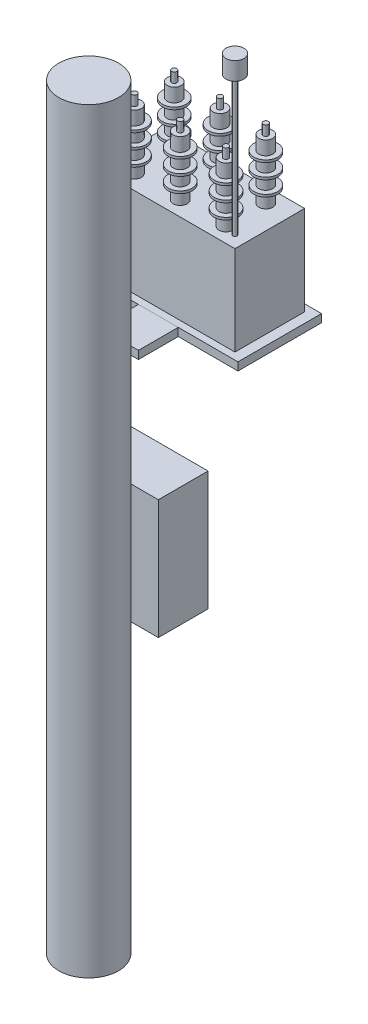
from build123d import *

# Parameters (mm, degrees)
SKETCH1_W               = 700
SKETCH1_H               = 350
TANK_DEPTH              = 450
FRAME_START             = -40
SKETCH2_W               = 800
SKETCH2_H               = 420
FRAME_DEPTH             = 40
SKETCH3_W               = 200
SKETCH3_H               = 200
FRAME_ARM_DEPTH         = 40
CONTROL_START           = -1200
SKETCH4_W               = 400
SKETCH4_H               = 250
CONTROL_CABINET_DEPTH   = 600
POLE_START              = -2600
SKETCH5_R               = 150
POLE_DEPTH              = 3800
BUSHING_START           = 450
SKETCH6_R               = 35
BUSHING_SOURCE_A_DEPTH  = 300
SHED_START              = 519
SKETCH7_R               = 60
SHED_SOURCE_A_1_DEPTH   = 12
SHED_START_2            = 594
SKETCH8_R               = 60
SHED_SOURCE_A_2_DEPTH   = 12
SHED_START_3            = 669
SKETCH9_R               = 60
SHED_SOURCE_A_3_DEPTH   = 12
TERMINAL_START          = 750
SKETCH10_R              = 13
TERMINAL_SOURCE_A_DEPTH = 50
SKETCH11_R              = 35
BUSHING_SOURCE_B_DEPTH  = 300
SKETCH12_R              = 60
SHED_SOURCE_B_1_DEPTH   = 12
SKETCH13_R              = 60
SHED_SOURCE_B_2_DEPTH   = 12
SKETCH14_R              = 60
SHED_SOURCE_B_3_DEPTH   = 12
SKETCH15_R              = 13
TERMINAL_SOURCE_B_DEPTH = 50
SKETCH16_R              = 35
BUSHING_SOURCE_C_DEPTH  = 300
SKETCH17_R              = 60
SHED_SOURCE_C_1_DEPTH   = 12
SKETCH18_R              = 60
SHED_SOURCE_C_2_DEPTH   = 12
SKETCH19_R              = 60
SHED_SOURCE_C_3_DEPTH   = 12
SKETCH20_R              = 13
TERMINAL_SOURCE_C_DEPTH = 50
SKETCH21_R              = 35
BUSHING_LOAD_A_DEPTH    = 300
SKETCH22_R              = 60
SHED_LOAD_A_1_DEPTH     = 12
SKETCH23_R              = 60
SHED_LOAD_A_2_DEPTH     = 12
SKETCH24_R              = 60
SHED_LOAD_A_3_DEPTH     = 12
SKETCH25_R              = 13
TERMINAL_LOAD_A_DEPTH   = 50
SKETCH26_R              = 35
BUSHING_LOAD_B_DEPTH    = 300
SKETCH27_R              = 60
SHED_LOAD_B_1_DEPTH     = 12
SKETCH28_R              = 60
SHED_LOAD_B_2_DEPTH     = 12
SKETCH29_R              = 60
SHED_LOAD_B_3_DEPTH     = 12
SKETCH30_R              = 13
TERMINAL_LOAD_B_DEPTH   = 50
SKETCH31_R              = 35
BUSHING_LOAD_C_DEPTH    = 300
SKETCH32_R              = 60
SHED_LOAD_C_1_DEPTH     = 12
SKETCH33_R              = 60
SHED_LOAD_C_2_DEPTH     = 12
SKETCH34_R              = 60
SHED_LOAD_C_3_DEPTH     = 12
SKETCH35_R              = 13
TERMINAL_LOAD_C_DEPTH   = 50
ANTENNA_START           = 450
SKETCH36_R              = 10
ANTENNA_MAST_DEPTH      = 700
ANTENNA_START_2         = 1150
SKETCH37_R              = 45
ANTENNA_RADOME_DEPTH    = 90


with BuildPart() as part:
    # Sketch1 → Tank (new body)
    with BuildSketch(Plane(origin=(0, 0, 0), x_dir=(1, 0, 0), z_dir=(0, 1, 0))):
        Rectangle(SKETCH1_W, SKETCH1_H)
    extrude(amount=TANK_DEPTH)


with BuildPart() as body_2:
    # Sketch2 → Frame (new body)
    with BuildSketch(Plane(origin=(0, 0, 0), x_dir=(1, 0, 0), z_dir=(0, 1, 0)).offset(FRAME_START)):
        Rectangle(SKETCH2_W, SKETCH2_H)
    extrude(amount=FRAME_DEPTH)


with BuildPart() as body_3:
    # Sketch3 → Frame arm (new body)
    with BuildSketch(Plane(origin=(0, 0, 0), x_dir=(1, 0, 0), z_dir=(0, 1, 0)).offset(FRAME_START)):
        with Locations((0, -310)):
            Rectangle(SKETCH3_W, SKETCH3_H)
    extrude(amount=FRAME_ARM_DEPTH)


with BuildPart() as body_4:
    # Sketch4 → Control cabinet (new body)
    with BuildSketch(Plane(origin=(0, 0, 0), x_dir=(1, 0, 0), z_dir=(0, 1, 0)).offset(CONTROL_START)):
        with Locations((0, -285)):
            Rectangle(SKETCH4_W, SKETCH4_H)
    extrude(amount=CONTROL_CABINET_DEPTH)


with BuildPart() as body_5:
    # Sketch5 → Pole (new body)
    with BuildSketch(Plane(origin=(0, 0, 0), x_dir=(1, 0, 0), z_dir=(0, 1, 0)).offset(POLE_START)):
        with Locations(Location((0, -560, 0), (0, 0, 90))):
            Circle(SKETCH5_R)
    extrude(amount=POLE_DEPTH)


with BuildPart() as body_6:
    # Sketch6 → Bushing Source A (new body)
    with BuildSketch(Plane(origin=(0, 0, 0), x_dir=(1, 0, 0), z_dir=(0, 1, 0)).offset(BUSHING_START)):
        with Locations(Location((-230, 100, 0), (0, 0, 270))):
            Circle(SKETCH6_R)
    extrude(amount=BUSHING_SOURCE_A_DEPTH)


with BuildPart() as body_7:
    # Sketch7 → Shed Source A 1 (new body)
    with BuildSketch(Plane(origin=(0, 0, 0), x_dir=(1, 0, 0), z_dir=(0, 1, 0)).offset(SHED_START)):
        with Locations(Location((-230, 100, 0), (0, 0, 270))):
            Circle(SKETCH7_R)
    extrude(amount=SHED_SOURCE_A_1_DEPTH)


with BuildPart() as body_8:
    # Sketch8 → Shed Source A 2 (new body)
    with BuildSketch(Plane(origin=(0, 0, 0), x_dir=(1, 0, 0), z_dir=(0, 1, 0)).offset(SHED_START_2)):
        with Locations(Location((-230, 100, 0), (0, 0, 270))):
            Circle(SKETCH8_R)
    extrude(amount=SHED_SOURCE_A_2_DEPTH)


with BuildPart() as body_9:
    # Sketch9 → Shed Source A 3 (new body)
    with BuildSketch(Plane(origin=(0, 0, 0), x_dir=(1, 0, 0), z_dir=(0, 1, 0)).offset(SHED_START_3)):
        with Locations(Location((-230, 100, 0), (0, 0, 270))):
            Circle(SKETCH9_R)
    extrude(amount=SHED_SOURCE_A_3_DEPTH)


with BuildPart() as body_10:
    # Sketch10 → Terminal Source A (new body)
    with BuildSketch(Plane(origin=(0, 0, 0), x_dir=(1, 0, 0), z_dir=(0, 1, 0)).offset(TERMINAL_START)):
        with Locations(Location((-230, 100, 0), (0, 0, 270))):
            Circle(SKETCH10_R)
    extrude(amount=TERMINAL_SOURCE_A_DEPTH)


with BuildPart() as body_11:
    # Sketch11 → Bushing Source B (new body)
    with BuildSketch(Plane(origin=(0, 0, 0), x_dir=(1, 0, 0), z_dir=(0, 1, 0)).offset(BUSHING_START)):
        with Locations(Location((0, 100, 0), (0, 0, 270))):
            Circle(SKETCH11_R)
    extrude(amount=BUSHING_SOURCE_B_DEPTH)


with BuildPart() as body_12:
    # Sketch12 → Shed Source B 1 (new body)
    with BuildSketch(Plane(origin=(0, 0, 0), x_dir=(1, 0, 0), z_dir=(0, 1, 0)).offset(SHED_START)):
        with Locations(Location((0, 100, 0), (0, 0, 270))):
            Circle(SKETCH12_R)
    extrude(amount=SHED_SOURCE_B_1_DEPTH)


with BuildPart() as body_13:
    # Sketch13 → Shed Source B 2 (new body)
    with BuildSketch(Plane(origin=(0, 0, 0), x_dir=(1, 0, 0), z_dir=(0, 1, 0)).offset(SHED_START_2)):
        with Locations(Location((0, 100, 0), (0, 0, 270))):
            Circle(SKETCH13_R)
    extrude(amount=SHED_SOURCE_B_2_DEPTH)


with BuildPart() as body_14:
    # Sketch14 → Shed Source B 3 (new body)
    with BuildSketch(Plane(origin=(0, 0, 0), x_dir=(1, 0, 0), z_dir=(0, 1, 0)).offset(SHED_START_3)):
        with Locations(Location((0, 100, 0), (0, 0, 270))):
            Circle(SKETCH14_R)
    extrude(amount=SHED_SOURCE_B_3_DEPTH)


with BuildPart() as body_15:
    # Sketch15 → Terminal Source B (new body)
    with BuildSketch(Plane(origin=(0, 0, 0), x_dir=(1, 0, 0), z_dir=(0, 1, 0)).offset(TERMINAL_START)):
        with Locations(Location((0, 100, 0), (0, 0, 270))):
            Circle(SKETCH15_R)
    extrude(amount=TERMINAL_SOURCE_B_DEPTH)


with BuildPart() as body_16:
    # Sketch16 → Bushing Source C (new body)
    with BuildSketch(Plane(origin=(0, 0, 0), x_dir=(1, 0, 0), z_dir=(0, 1, 0)).offset(BUSHING_START)):
        with Locations(Location((230, 100, 0), (0, 0, 270))):
            Circle(SKETCH16_R)
    extrude(amount=BUSHING_SOURCE_C_DEPTH)


with BuildPart() as body_17:
    # Sketch17 → Shed Source C 1 (new body)
    with BuildSketch(Plane(origin=(0, 0, 0), x_dir=(1, 0, 0), z_dir=(0, 1, 0)).offset(SHED_START)):
        with Locations(Location((230, 100, 0), (0, 0, 270))):
            Circle(SKETCH17_R)
    extrude(amount=SHED_SOURCE_C_1_DEPTH)


with BuildPart() as body_18:
    # Sketch18 → Shed Source C 2 (new body)
    with BuildSketch(Plane(origin=(0, 0, 0), x_dir=(1, 0, 0), z_dir=(0, 1, 0)).offset(SHED_START_2)):
        with Locations(Location((230, 100, 0), (0, 0, 270))):
            Circle(SKETCH18_R)
    extrude(amount=SHED_SOURCE_C_2_DEPTH)


with BuildPart() as body_19:
    # Sketch19 → Shed Source C 3 (new body)
    with BuildSketch(Plane(origin=(0, 0, 0), x_dir=(1, 0, 0), z_dir=(0, 1, 0)).offset(SHED_START_3)):
        with Locations(Location((230, 100, 0), (0, 0, 270))):
            Circle(SKETCH19_R)
    extrude(amount=SHED_SOURCE_C_3_DEPTH)


with BuildPart() as body_20:
    # Sketch20 → Terminal Source C (new body)
    with BuildSketch(Plane(origin=(0, 0, 0), x_dir=(1, 0, 0), z_dir=(0, 1, 0)).offset(TERMINAL_START)):
        with Locations(Location((230, 100, 0), (0, 0, 270))):
            Circle(SKETCH20_R)
    extrude(amount=TERMINAL_SOURCE_C_DEPTH)


with BuildPart() as body_21:
    # Sketch21 → Bushing Load A (new body)
    with BuildSketch(Plane(origin=(0, 0, 0), x_dir=(1, 0, 0), z_dir=(0, 1, 0)).offset(BUSHING_START)):
        with Locations(Location((-230, -100, 0), (0, 0, 270))):
            Circle(SKETCH21_R)
    extrude(amount=BUSHING_LOAD_A_DEPTH)


with BuildPart() as body_22:
    # Sketch22 → Shed Load A 1 (new body)
    with BuildSketch(Plane(origin=(0, 0, 0), x_dir=(1, 0, 0), z_dir=(0, 1, 0)).offset(SHED_START)):
        with Locations(Location((-230, -100, 0), (0, 0, 270))):
            Circle(SKETCH22_R)
    extrude(amount=SHED_LOAD_A_1_DEPTH)


with BuildPart() as body_23:
    # Sketch23 → Shed Load A 2 (new body)
    with BuildSketch(Plane(origin=(0, 0, 0), x_dir=(1, 0, 0), z_dir=(0, 1, 0)).offset(SHED_START_2)):
        with Locations(Location((-230, -100, 0), (0, 0, 270))):
            Circle(SKETCH23_R)
    extrude(amount=SHED_LOAD_A_2_DEPTH)


with BuildPart() as body_24:
    # Sketch24 → Shed Load A 3 (new body)
    with BuildSketch(Plane(origin=(0, 0, 0), x_dir=(1, 0, 0), z_dir=(0, 1, 0)).offset(SHED_START_3)):
        with Locations(Location((-230, -100, 0), (0, 0, 270))):
            Circle(SKETCH24_R)
    extrude(amount=SHED_LOAD_A_3_DEPTH)


with BuildPart() as body_25:
    # Sketch25 → Terminal Load A (new body)
    with BuildSketch(Plane(origin=(0, 0, 0), x_dir=(1, 0, 0), z_dir=(0, 1, 0)).offset(TERMINAL_START)):
        with Locations(Location((-230, -100, 0), (0, 0, 270))):
            Circle(SKETCH25_R)
    extrude(amount=TERMINAL_LOAD_A_DEPTH)


with BuildPart() as body_26:
    # Sketch26 → Bushing Load B (new body)
    with BuildSketch(Plane(origin=(0, 0, 0), x_dir=(1, 0, 0), z_dir=(0, 1, 0)).offset(BUSHING_START)):
        with Locations(Location((0, -100, 0), (0, 0, 270))):
            Circle(SKETCH26_R)
    extrude(amount=BUSHING_LOAD_B_DEPTH)


with BuildPart() as body_27:
    # Sketch27 → Shed Load B 1 (new body)
    with BuildSketch(Plane(origin=(0, 0, 0), x_dir=(1, 0, 0), z_dir=(0, 1, 0)).offset(SHED_START)):
        with Locations(Location((0, -100, 0), (0, 0, 270))):
            Circle(SKETCH27_R)
    extrude(amount=SHED_LOAD_B_1_DEPTH)


with BuildPart() as body_28:
    # Sketch28 → Shed Load B 2 (new body)
    with BuildSketch(Plane(origin=(0, 0, 0), x_dir=(1, 0, 0), z_dir=(0, 1, 0)).offset(SHED_START_2)):
        with Locations(Location((0, -100, 0), (0, 0, 270))):
            Circle(SKETCH28_R)
    extrude(amount=SHED_LOAD_B_2_DEPTH)


with BuildPart() as body_29:
    # Sketch29 → Shed Load B 3 (new body)
    with BuildSketch(Plane(origin=(0, 0, 0), x_dir=(1, 0, 0), z_dir=(0, 1, 0)).offset(SHED_START_3)):
        with Locations(Location((0, -100, 0), (0, 0, 270))):
            Circle(SKETCH29_R)
    extrude(amount=SHED_LOAD_B_3_DEPTH)


with BuildPart() as body_30:
    # Sketch30 → Terminal Load B (new body)
    with BuildSketch(Plane(origin=(0, 0, 0), x_dir=(1, 0, 0), z_dir=(0, 1, 0)).offset(TERMINAL_START)):
        with Locations(Location((0, -100, 0), (0, 0, 270))):
            Circle(SKETCH30_R)
    extrude(amount=TERMINAL_LOAD_B_DEPTH)


with BuildPart() as body_31:
    # Sketch31 → Bushing Load C (new body)
    with BuildSketch(Plane(origin=(0, 0, 0), x_dir=(1, 0, 0), z_dir=(0, 1, 0)).offset(BUSHING_START)):
        with Locations(Location((230, -100, 0), (0, 0, 270))):
            Circle(SKETCH31_R)
    extrude(amount=BUSHING_LOAD_C_DEPTH)


with BuildPart() as body_32:
    # Sketch32 → Shed Load C 1 (new body)
    with BuildSketch(Plane(origin=(0, 0, 0), x_dir=(1, 0, 0), z_dir=(0, 1, 0)).offset(SHED_START)):
        with Locations(Location((230, -100, 0), (0, 0, 270))):
            Circle(SKETCH32_R)
    extrude(amount=SHED_LOAD_C_1_DEPTH)


with BuildPart() as body_33:
    # Sketch33 → Shed Load C 2 (new body)
    with BuildSketch(Plane(origin=(0, 0, 0), x_dir=(1, 0, 0), z_dir=(0, 1, 0)).offset(SHED_START_2)):
        with Locations(Location((230, -100, 0), (0, 0, 270))):
            Circle(SKETCH33_R)
    extrude(amount=SHED_LOAD_C_2_DEPTH)


with BuildPart() as body_34:
    # Sketch34 → Shed Load C 3 (new body)
    with BuildSketch(Plane(origin=(0, 0, 0), x_dir=(1, 0, 0), z_dir=(0, 1, 0)).offset(SHED_START_3)):
        with Locations(Location((230, -100, 0), (0, 0, 270))):
            Circle(SKETCH34_R)
    extrude(amount=SHED_LOAD_C_3_DEPTH)


with BuildPart() as body_35:
    # Sketch35 → Terminal Load C (new body)
    with BuildSketch(Plane(origin=(0, 0, 0), x_dir=(1, 0, 0), z_dir=(0, 1, 0)).offset(TERMINAL_START)):
        with Locations(Location((230, -100, 0), (0, 0, 270))):
            Circle(SKETCH35_R)
    extrude(amount=TERMINAL_LOAD_C_DEPTH)


with BuildPart() as body_36:
    # Sketch36 → Antenna mast (new body)
    with BuildSketch(Plane(origin=(0, 0, 0), x_dir=(1, 0, 0), z_dir=(0, 1, 0)).offset(ANTENNA_START)):
        with Locations(Location((290, -115, 0), (0, 0, 270))):
            Circle(SKETCH36_R)
    extrude(amount=ANTENNA_MAST_DEPTH)


with BuildPart() as body_37:
    # Sketch37 → Antenna radome (new body)
    with BuildSketch(Plane(origin=(0, 0, 0), x_dir=(1, 0, 0), z_dir=(0, 1, 0)).offset(ANTENNA_START_2)):
        with Locations(Location((290, -115, 0), (0, 0, 90))):
            Circle(SKETCH37_R)
    extrude(amount=ANTENNA_RADOME_DEPTH)


solid = Compound([part.part, body_2.part, body_3.part, body_4.part, body_5.part, body_6.part, body_7.part, body_8.part, body_9.part, body_10.part, body_11.part, body_12.part, body_13.part, body_14.part, body_15.part, body_16.part, body_17.part, body_18.part, body_19.part, body_20.part, body_21.part, body_22.part, body_23.part, body_24.part, body_25.part, body_26.part, body_27.part, body_28.part, body_29.part, body_30.part, body_31.part, body_32.part, body_33.part, body_34.part, body_35.part, body_36.part, body_37.part])
